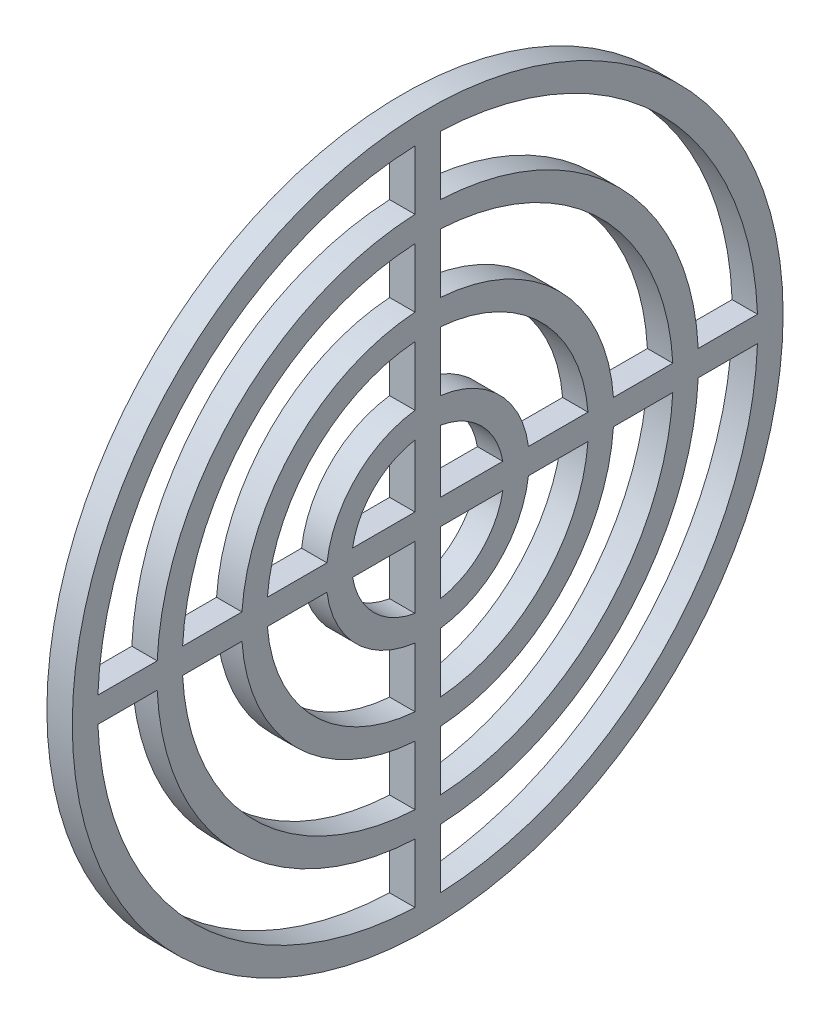
from build123d import *

# Parameters (mm, degrees)
SKETCH1_R           = 42
BOSS_EXTRUDE1_DEPTH = 1.5


with BuildPart() as part:
    # Sketch1 → Boss-Extrude1 (new, symmetric)
    with BuildSketch(Plane(origin=(0, 0, 0), x_dir=(0, 0, -1), z_dir=(1, 0, 0))):
        Circle(SKETCH1_R)
        with BuildLine():
            Line((-1.5, 38.97114317), (-1.5, 31.964824417))
            ThreePointArc((-1.5, 31.964824417), (-22.627416998, 22.627416998), (-31.964824417, 1.5))
            Line((-31.964824417, 1.5), (-38.97114317, 1.5))
            ThreePointArc((-38.97114317, 1.5), (-27.577164466, 27.577164466), (-1.5, 38.97114317))
        make_face(mode=Mode.SUBTRACT)
        with BuildLine():
            Line((1.5, 38.97114317), (1.5, 31.964824417))
            ThreePointArc((1.5, 31.964824417), (22.627416998, 22.627416998), (31.964824417, 1.5))
            Line((31.964824417, 1.5), (38.97114317, 1.5))
            ThreePointArc((38.97114317, 1.5), (27.577164466, 27.577164466), (1.5, 38.97114317))
        make_face(mode=Mode.SUBTRACT)
        with BuildLine():
            Line((38.97114317, -1.5), (31.964824417, -1.5))
            ThreePointArc((31.964824417, -1.5), (22.627416998, -22.627416998), (1.5, -31.964824417))
            Line((1.5, -31.964824417), (1.5, -38.97114317))
            ThreePointArc((1.5, -38.97114317), (27.577164466, -27.577164466), (38.97114317, -1.5))
        make_face(mode=Mode.SUBTRACT)
        with BuildLine():
            Line((-1.5, -38.97114317), (-1.5, -31.964824417))
            ThreePointArc((-1.5, -31.964824417), (-22.627416998, -22.627416998), (-31.964824417, -1.5))
            Line((-31.964824417, -1.5), (-38.97114317, -1.5))
            ThreePointArc((-38.97114317, -1.5), (-27.577164466, -27.577164466), (-1.5, -38.97114317))
        make_face(mode=Mode.SUBTRACT)
        with BuildLine():
            Line((-28.961180915, 1.5), (-21.948804068, 1.5))
            ThreePointArc((-21.948804068, 1.5), (-15.556349186, 15.556349186), (-1.5, 21.948804068))
            Line((-1.5, 21.948804068), (-1.5, 28.961180915))
            ThreePointArc((-1.5, 28.961180915), (-20.506096654, 20.506096654), (-28.961180915, 1.5))
        make_face(mode=Mode.SUBTRACT)
        with BuildLine():
            Line((-18.940696925, 1.5), (-11.9058809, 1.5))
            ThreePointArc((-11.9058809, 1.5), (-8.485281374, 8.485281374), (-1.5, 11.9058809))
            Line((-1.5, 11.9058809), (-1.5, 18.940696925))
            ThreePointArc((-1.5, 18.940696925), (-13.435028843, 13.435028843), (-18.940696925, 1.5))
        make_face(mode=Mode.SUBTRACT)
        with BuildLine():
            Line((-8.874119675, 1.5), (-1.5, 1.5))
            Line((-1.5, 1.5), (-1.5, 8.874119675))
            ThreePointArc((-1.5, 8.874119675), (-6.363961031, 6.363961031), (-8.874119675, 1.5))
        make_face(mode=Mode.SUBTRACT)
        with BuildLine():
            Line((-28.961180915, -1.5), (-21.948804068, -1.5))
            ThreePointArc((-21.948804068, -1.5), (-15.556349186, -15.556349186), (-1.5, -21.948804068))
            Line((-1.5, -21.948804068), (-1.5, -28.961180915))
            ThreePointArc((-1.5, -28.961180915), (-20.506096654, -20.506096654), (-28.961180915, -1.5))
        make_face(mode=Mode.SUBTRACT)
        with BuildLine():
            Line((-18.940696925, -1.5), (-11.9058809, -1.5))
            ThreePointArc((-11.9058809, -1.5), (-8.485281374, -8.485281374), (-1.5, -11.9058809))
            Line((-1.5, -11.9058809), (-1.5, -18.940696925))
            ThreePointArc((-1.5, -18.940696925), (-13.435028843, -13.435028843), (-18.940696925, -1.5))
        make_face(mode=Mode.SUBTRACT)
        with BuildLine():
            Line((-8.874119675, -1.5), (-1.5, -1.5))
            Line((-1.5, -1.5), (-1.5, -8.874119675))
            ThreePointArc((-1.5, -8.874119675), (-6.363961031, -6.363961031), (-8.874119675, -1.5))
        make_face(mode=Mode.SUBTRACT)
        with BuildLine():
            Line((1.5, -28.961180915), (1.5, -21.948804068))
            ThreePointArc((1.5, -21.948804068), (15.556349186, -15.556349186), (21.948804068, -1.5))
            Line((21.948804068, -1.5), (28.961180915, -1.5))
            ThreePointArc((28.961180915, -1.5), (20.506096654, -20.506096654), (1.5, -28.961180915))
        make_face(mode=Mode.SUBTRACT)
        with BuildLine():
            Line((1.5, -18.940696925), (1.5, -11.9058809))
            ThreePointArc((1.5, -11.9058809), (8.485281374, -8.485281374), (11.9058809, -1.5))
            Line((11.9058809, -1.5), (18.940696925, -1.5))
            ThreePointArc((18.940696925, -1.5), (13.435028843, -13.435028843), (1.5, -18.940696925))
        make_face(mode=Mode.SUBTRACT)
        with BuildLine():
            Line((1.5, -8.874119675), (1.5, -1.5))
            Line((1.5, -1.5), (8.874119675, -1.5))
            ThreePointArc((8.874119675, -1.5), (6.363961031, -6.363961031), (1.5, -8.874119675))
        make_face(mode=Mode.SUBTRACT)
        with BuildLine():
            Line((8.874119675, 1.5), (1.5, 1.5))
            Line((1.5, 1.5), (1.5, 8.874119675))
            ThreePointArc((1.5, 8.874119675), (6.363961031, 6.363961031), (8.874119675, 1.5))
        make_face(mode=Mode.SUBTRACT)
        with BuildLine():
            Line((18.940696925, 1.5), (11.9058809, 1.5))
            ThreePointArc((11.9058809, 1.5), (8.485281374, 8.485281374), (1.5, 11.9058809))
            Line((1.5, 11.9058809), (1.5, 18.940696925))
            ThreePointArc((1.5, 18.940696925), (13.435028843, 13.435028843), (18.940696925, 1.5))
        make_face(mode=Mode.SUBTRACT)
        with BuildLine():
            Line((28.961180915, 1.5), (21.948804068, 1.5))
            ThreePointArc((21.948804068, 1.5), (15.556349186, 15.556349186), (1.5, 21.948804068))
            Line((1.5, 21.948804068), (1.5, 28.961180915))
            ThreePointArc((1.5, 28.961180915), (20.506096654, 20.506096654), (28.961180915, 1.5))
        make_face(mode=Mode.SUBTRACT)
    extrude(amount=BOSS_EXTRUDE1_DEPTH, both=True)


solid = part.part
